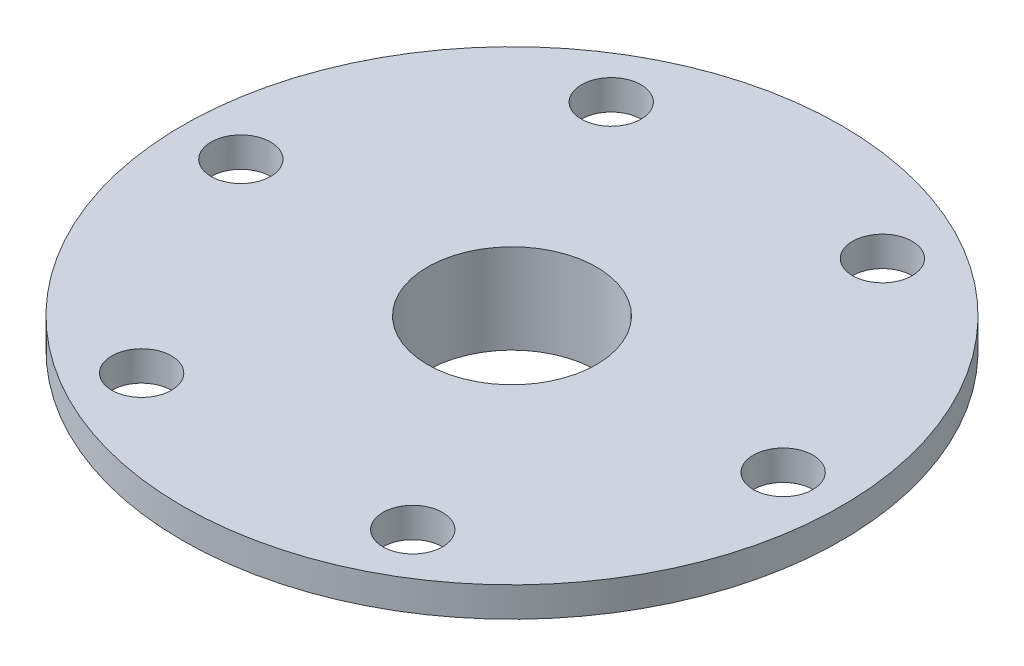
from build123d import *

# Parameters (mm, degrees)
SKETCH5_R          = 3
CUT_EXTRUDE1_DEPTH = 48.728569307


with BuildPart() as part:
    # Sketch4 → Revolve1 (revolve)
    with BuildSketch(Plane.XY, mode=Mode.PRIVATE) as revolve1_sk:
        Polygon((-8.5, 0), (-33.14375, 0), (-33.14375, -3), (-12.25, -3), (-12.25, -9), (-8.5, -9), align=None)
    revolve(revolve1_sk.sketch.rotate(Axis((0, 27.279243053, 0), (0, -1, 0)), 270), axis=Axis((0, 27.279243053, 0), (0, -1, 0)))

    # Sketch5 → Cut-Extrude1 (cut, through all)
    with BuildSketch(Plane(origin=(0, 0, 0), x_dir=(1, 0, 0), z_dir=(0, 1, 0))):
        with Locations(Location((-27.26875, 0, 0), (0, 0, 270))):
            Circle(SKETCH5_R)
        with Locations(Location((-13.634375, 23.615430229, 0), (0, 0, 270))):
            Circle(SKETCH5_R)
        with Locations(Location((13.634375, 23.615430229, 0), (0, 0, 270))):
            Circle(SKETCH5_R)
        with Locations(Location((27.26875, 0, 0), (0, 0, 270))):
            Circle(SKETCH5_R)
        with Locations(Location((13.634375, -23.615430229, 0), (0, 0, 270))):
            Circle(SKETCH5_R)
        with Locations(Location((-13.634375, -23.615430229, 0), (0, 0, 270))):
            Circle(SKETCH5_R)
    extrude(amount=-CUT_EXTRUDE1_DEPTH, mode=Mode.SUBTRACT)


solid = part.part
